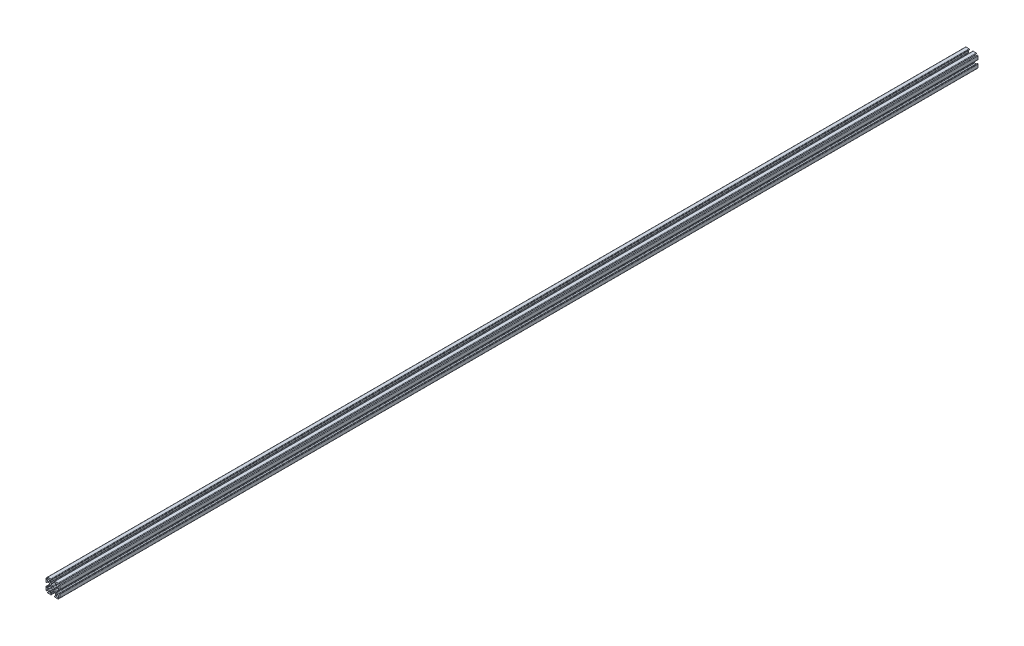
from build123d import *

# Parameters (mm, degrees)
SKETCH1_R           = 1.25
BOSS_EXTRUDE1_DEPTH = 1000


with BuildPart() as part:
    # Sketch1 → Boss-Extrude1 (new body)
    with BuildSketch(Plane(origin=(0, 0, 0), x_dir=(-1, 0, 0), z_dir=(0, 0, -1))):
        with BuildLine():
            Line((6.646446609, 5.939339828), (6.163645978, 5.456539197))
            ThreePointArc((6.163645978, 5.456539197), (4.116116524, 4.116116524), (5.456539197, 6.163645978))
            Line((5.456539197, 6.163645978), (5.939339828, 6.646446609))
            ThreePointArc((5.939339828, 6.646446609), (6.047726204, 7.191341716), (5.585786438, 7.5))
            Line((5.585786438, 7.5), (2.25, 7.5))
            ThreePointArc((2.25, 7.5), (1.896446609, 7.353553391), (1.75, 7))
            Line((1.75, 7), (1.75, 6.8))
            ThreePointArc((1.75, 6.8), (1.896446609, 6.446446609), (2.25, 6.3))
            Line((2.25, 6.3), (2.65, 6.3))
            ThreePointArc((2.65, 6.3), (2.791421356, 6.241421356), (2.85, 6.1))
            Line((2.85, 6.1), (2.85, 4))
            ThreePointArc((2.85, 4), (2.703553391, 3.646446609), (2.35, 3.5))
            Line((2.35, 3.5), (2.1, 3.5))
            ThreePointArc((2.1, 3.5), (1.746446609, 3.353553391), (1.6, 3))
            ThreePointArc((1.6, 3), (1.307106781, 2.292893219), (0.6, 2))
            Line((0.6, 2), (-0.6, 2))
            ThreePointArc((-0.6, 2), (-1.307106781, 2.292893219), (-1.6, 3))
            ThreePointArc((-1.6, 3), (-1.746446609, 3.353553391), (-2.1, 3.5))
            Line((-2.1, 3.5), (-2.35, 3.5))
            ThreePointArc((-2.35, 3.5), (-2.703553391, 3.646446609), (-2.85, 4))
            Line((-2.85, 4), (-2.85, 6.1))
            ThreePointArc((-2.85, 6.1), (-2.791421356, 6.241421356), (-2.65, 6.3))
            Line((-2.65, 6.3), (-2.25, 6.3))
            ThreePointArc((-2.25, 6.3), (-1.896446609, 6.446446609), (-1.75, 6.8))
            Line((-1.75, 6.8), (-1.75, 7))
            ThreePointArc((-1.75, 7), (-1.896446609, 7.353553391), (-2.25, 7.5))
            Line((-2.25, 7.5), (-5.585786438, 7.5))
            ThreePointArc((-5.585786438, 7.5), (-6.047726204, 7.191341716), (-5.939339828, 6.646446609))
            Line((-5.939339828, 6.646446609), (-5.456539197, 6.163645978))
            ThreePointArc((-5.456539197, 6.163645978), (-4.116116524, 4.116116524), (-6.163645978, 5.456539197))
            Line((-6.163645978, 5.456539197), (-6.646446609, 5.939339828))
            ThreePointArc((-6.646446609, 5.939339828), (-7.191341716, 6.047726204), (-7.5, 5.585786438))
            Line((-7.5, 5.585786438), (-7.5, 2.25))
            ThreePointArc((-7.5, 2.25), (-7.353553391, 1.896446609), (-7, 1.75))
            Line((-7, 1.75), (-6.8, 1.75))
            ThreePointArc((-6.8, 1.75), (-6.446446609, 1.896446609), (-6.3, 2.25))
            Line((-6.3, 2.25), (-6.3, 2.65))
            ThreePointArc((-6.3, 2.65), (-6.241421356, 2.791421356), (-6.1, 2.85))
            Line((-6.1, 2.85), (-4, 2.85))
            ThreePointArc((-4, 2.85), (-3.646446609, 2.703553391), (-3.5, 2.35))
            Line((-3.5, 2.35), (-3.5, 2.1))
            ThreePointArc((-3.5, 2.1), (-3.353553391, 1.746446609), (-3, 1.6))
            ThreePointArc((-3, 1.6), (-2.292893219, 1.307106781), (-2, 0.6))
            Line((-2, 0.6), (-2, -0.6))
            ThreePointArc((-2, -0.6), (-2.292893219, -1.307106781), (-3, -1.6))
            ThreePointArc((-3, -1.6), (-3.353553391, -1.746446609), (-3.5, -2.1))
            Line((-3.5, -2.1), (-3.5, -2.35))
            ThreePointArc((-3.5, -2.35), (-3.646446609, -2.703553391), (-4, -2.85))
            Line((-4, -2.85), (-6.1, -2.85))
            ThreePointArc((-6.1, -2.85), (-6.241421356, -2.791421356), (-6.3, -2.65))
            Line((-6.3, -2.65), (-6.3, -2.25))
            ThreePointArc((-6.3, -2.25), (-6.446446609, -1.896446609), (-6.8, -1.75))
            Line((-6.8, -1.75), (-7, -1.75))
            ThreePointArc((-7, -1.75), (-7.353553391, -1.896446609), (-7.5, -2.25))
            Line((-7.5, -2.25), (-7.5, -5.585786438))
            ThreePointArc((-7.5, -5.585786438), (-7.191341716, -6.047726204), (-6.646446609, -5.939339828))
            Line((-6.646446609, -5.939339828), (-6.163645978, -5.456539197))
            ThreePointArc((-6.163645978, -5.456539197), (-4.116116524, -4.116116524), (-5.456539197, -6.163645978))
            Line((-5.456539197, -6.163645978), (-5.939339828, -6.646446609))
            ThreePointArc((-5.939339828, -6.646446609), (-6.047726204, -7.191341716), (-5.585786438, -7.5))
            Line((-5.585786438, -7.5), (-2.25, -7.5))
            ThreePointArc((-2.25, -7.5), (-1.896446609, -7.353553391), (-1.75, -7))
            Line((-1.75, -7), (-1.75, -6.8))
            ThreePointArc((-1.75, -6.8), (-1.896446609, -6.446446609), (-2.25, -6.3))
            Line((-2.25, -6.3), (-2.65, -6.3))
            ThreePointArc((-2.65, -6.3), (-2.791421356, -6.241421356), (-2.85, -6.1))
            Line((-2.85, -6.1), (-2.85, -4))
            ThreePointArc((-2.85, -4), (-2.703553391, -3.646446609), (-2.35, -3.5))
            Line((-2.35, -3.5), (-2.1, -3.5))
            ThreePointArc((-2.1, -3.5), (-1.746446609, -3.353553391), (-1.6, -3))
            ThreePointArc((-1.6, -3), (-1.307106781, -2.292893219), (-0.6, -2))
            Line((-0.6, -2), (0.6, -2))
            ThreePointArc((0.6, -2), (1.307106781, -2.292893219), (1.6, -3))
            ThreePointArc((1.6, -3), (1.746446609, -3.353553391), (2.1, -3.5))
            Line((2.1, -3.5), (2.35, -3.5))
            ThreePointArc((2.35, -3.5), (2.703553391, -3.646446609), (2.85, -4))
            Line((2.85, -4), (2.85, -6.1))
            ThreePointArc((2.85, -6.1), (2.791421356, -6.241421356), (2.65, -6.3))
            Line((2.65, -6.3), (2.25, -6.3))
            ThreePointArc((2.25, -6.3), (1.896446609, -6.446446609), (1.75, -6.8))
            Line((1.75, -6.8), (1.75, -7))
            ThreePointArc((1.75, -7), (1.896446609, -7.353553391), (2.25, -7.5))
            Line((2.25, -7.5), (5.585786438, -7.5))
            ThreePointArc((5.585786438, -7.5), (6.047726204, -7.191341716), (5.939339828, -6.646446609))
            Line((5.939339828, -6.646446609), (5.456539197, -6.163645978))
            ThreePointArc((5.456539197, -6.163645978), (4.116116524, -4.116116524), (6.163645978, -5.456539197))
            Line((6.163645978, -5.456539197), (6.646446609, -5.939339828))
            ThreePointArc((6.646446609, -5.939339828), (7.191341716, -6.047726204), (7.5, -5.585786438))
            Line((7.5, -5.585786438), (7.5, -2.25))
            ThreePointArc((7.5, -2.25), (7.353553391, -1.896446609), (7, -1.75))
            Line((7, -1.75), (6.8, -1.75))
            ThreePointArc((6.8, -1.75), (6.446446609, -1.896446609), (6.3, -2.25))
            Line((6.3, -2.25), (6.3, -2.65))
            ThreePointArc((6.3, -2.65), (6.241421356, -2.791421356), (6.1, -2.85))
            Line((6.1, -2.85), (4, -2.85))
            ThreePointArc((4, -2.85), (3.646446609, -2.703553391), (3.5, -2.35))
            Line((3.5, -2.35), (3.5, -2.1))
            ThreePointArc((3.5, -2.1), (3.353553391, -1.746446609), (3, -1.6))
            ThreePointArc((3, -1.6), (2.292893219, -1.307106781), (2, -0.6))
            Line((2, -0.6), (2, 0.6))
            ThreePointArc((2, 0.6), (2.292893219, 1.307106781), (3, 1.6))
            ThreePointArc((3, 1.6), (3.353553391, 1.746446609), (3.5, 2.1))
            Line((3.5, 2.1), (3.5, 2.35))
            ThreePointArc((3.5, 2.35), (3.646446609, 2.703553391), (4, 2.85))
            Line((4, 2.85), (6.1, 2.85))
            ThreePointArc((6.1, 2.85), (6.241421356, 2.791421356), (6.3, 2.65))
            Line((6.3, 2.65), (6.3, 2.25))
            ThreePointArc((6.3, 2.25), (6.446446609, 1.896446609), (6.8, 1.75))
            Line((6.8, 1.75), (7, 1.75))
            ThreePointArc((7, 1.75), (7.353553391, 1.896446609), (7.5, 2.25))
            Line((7.5, 2.25), (7.5, 5.585786438))
            ThreePointArc((7.5, 5.585786438), (7.191341716, 6.047726204), (6.646446609, 5.939339828))
        make_face()
        with Locations(Location((0, 0, 0), (0, 0, 180))):
            Circle(SKETCH1_R, mode=Mode.SUBTRACT)
    extrude(amount=-BOSS_EXTRUDE1_DEPTH)


solid = part.part
